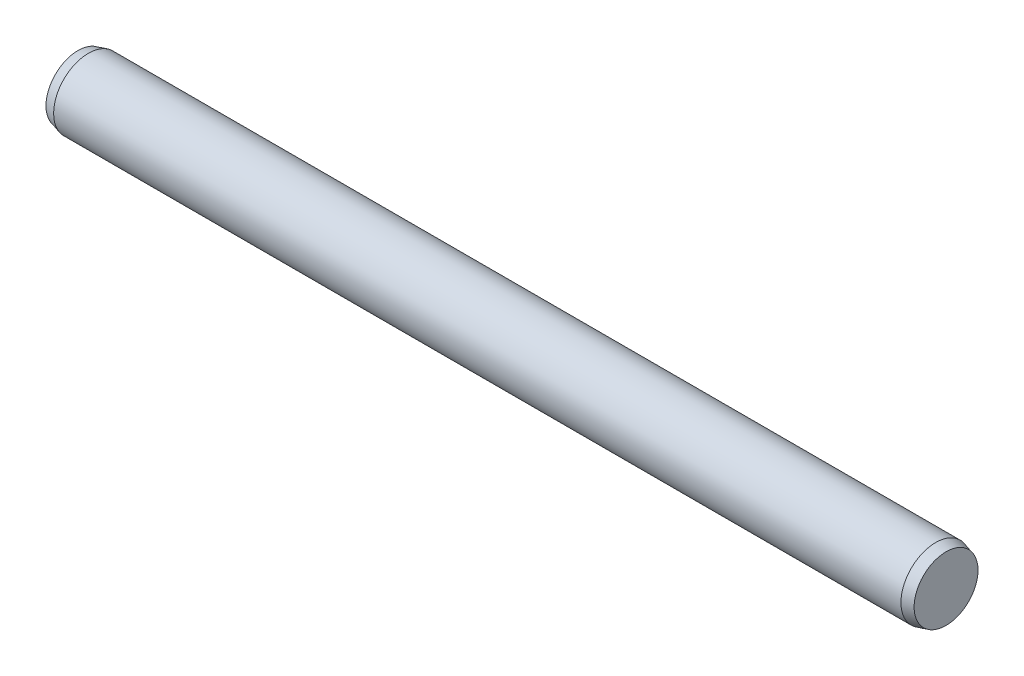
from build123d import *

# Parameters (mm, degrees)
EXTRUDE1_DEPTH      = 4.88
EXTRUDE1_DEPTH_BACK = 4.88
SKETCH2_R           = 0.4
SKETCH3_R           = 0.4
EXTRUDE2_DEPTH      = 0.12
EXTRUDE2_TAPER      = 15
SKETCH4_R           = 0.4
EXTRUDE3_DEPTH      = 0.12
EXTRUDE3_TAPER      = 15


with BuildPart() as part:
    # Sketch2 → Extrude1 (new, two sides: drawn at the far end of the back side and taken through both)
    with BuildSketch(Plane(origin=(0, 0, 0), x_dir=(0, 0, -1), z_dir=(1, 0, 0)).offset(-EXTRUDE1_DEPTH_BACK)):
        Circle(SKETCH2_R)
    extrude(amount=EXTRUDE1_DEPTH + EXTRUDE1_DEPTH_BACK)

    # Sketch3 → Extrude2 (add)
    with BuildSketch(Plane(origin=(4.88, 0, 0), x_dir=(0, 0, -1), z_dir=(1, 0, 0))):
        Circle(SKETCH3_R)
    extrude(amount=EXTRUDE2_DEPTH, taper=EXTRUDE2_TAPER)

    # Sketch4 → Extrude3 (add)
    with BuildSketch(Plane.ZY.offset(4.88)):
        with Locations(Location((0, 0, 0), (0, 0, 180))):
            Circle(SKETCH4_R)
    extrude(amount=EXTRUDE3_DEPTH, taper=EXTRUDE3_TAPER)


solid = part.part
